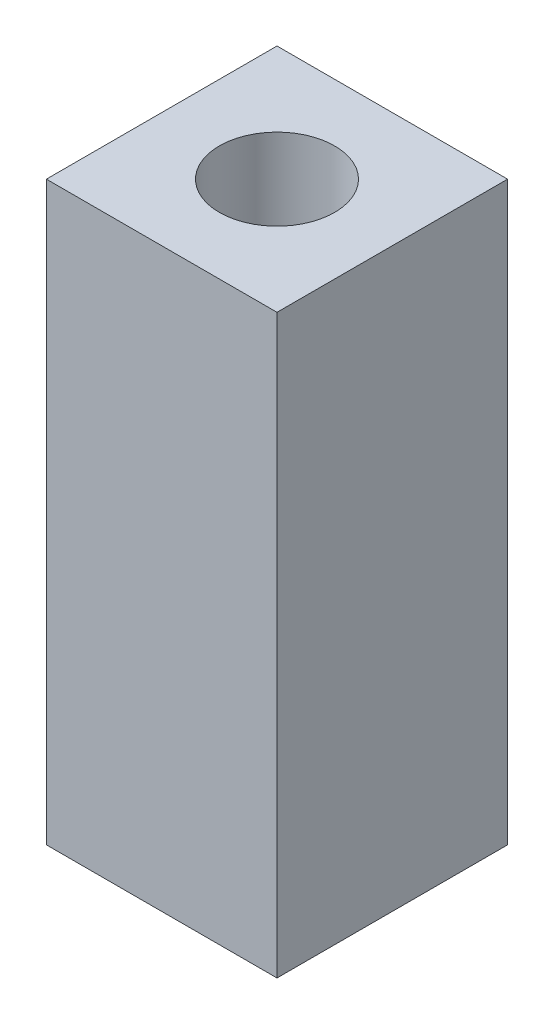
from build123d import *

# Parameters (mm, degrees)
SKETCH1_W           = 6
SKETCH1_H           = 6
BOSS_EXTRUDE1_DEPTH = 15
SKETCH2_R           = 1.5
CUT_EXTRUDE1_DEPTH  = 18.23368794


with BuildPart() as part:
    # Sketch1 → Boss-Extrude1 (new body)
    with BuildSketch(Plane(origin=(0, 0, 0), x_dir=(1, 0, 0), z_dir=(0, 1, 0))):
        with Locations((3, -3)):
            Rectangle(SKETCH1_W, SKETCH1_H)
    extrude(amount=BOSS_EXTRUDE1_DEPTH)

    # Sketch2 → Cut-Extrude1 (cut, through all)
    with BuildSketch(Plane(origin=(0, 15, 0), x_dir=(1, 0, 0), z_dir=(0, 1, 0))):
        with Locations(Location((3, -3, 0), (0, 0, 270))):
            Circle(SKETCH2_R)
    extrude(amount=-CUT_EXTRUDE1_DEPTH, mode=Mode.SUBTRACT)


solid = part.part
